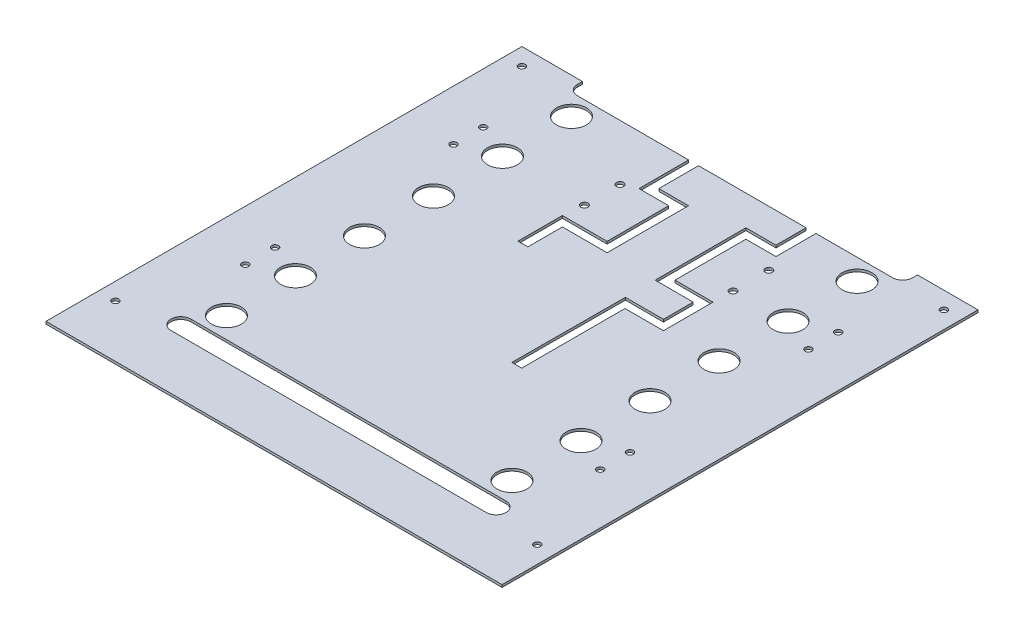
from build123d import *

# Parameters (mm, degrees)
SKETCH1_R                     = 2.15265
SKETCH1_R_2                   = 9.525
BOSS_EXTRUDE1_DEPTH           = 1.5875
CUT_EXTRUDE1_DEPTH            = 2.54
F_13_64_0_18_DIAMETER_HOLE1_D = 4.572


with BuildPart() as part:
    # Sketch1 → Boss-Extrude1 (new body)
    with BuildSketch(Plane(origin=(0, 0, 0), x_dir=(1, 0, 0), z_dir=(0, 1, 0))):
        with BuildLine():
            Line((-107.315, 152.4), (-146.05, 152.4))
            Line((-146.05, 152.4), (-146.05, -152.4))
            Line((-146.05, -152.4), (146.05, -152.4))
            Line((146.05, -152.4), (146.05, 152.4))
            Line((146.05, 152.4), (107.315, 152.4))
            Line((107.315, 152.4), (107.315, 149.225))
            ThreePointArc((107.315, 149.225), (105.455128061, 144.734871939), (100.965, 142.875))
            Line((100.965, 142.875), (-100.965, 142.875))
            ThreePointArc((-100.965, 142.875), (-105.455128061, 144.734871939), (-107.315, 149.225))
            Line((-107.315, 149.225), (-107.315, 152.4))
        make_face()
        with Locations(Location((-135.128, -118.872, 0), (0, 0, 270))):
            Circle(SKETCH1_R, mode=Mode.SUBTRACT)
        with Locations(Location((-91.44, -91.44, 0), (0, 0, 270))):
            Circle(SKETCH1_R_2, mode=Mode.SUBTRACT)
        with Locations(Location((-113.665, -57.15, 0), (0, 0, 270))):
            Circle(SKETCH1_R, mode=Mode.SUBTRACT)
        with Locations(Location((-113.665, -38.1, 0), (0, 0, 270))):
            Circle(SKETCH1_R, mode=Mode.SUBTRACT)
        with Locations(Location((-91.44, -47.244, 0), (0, 0, 270))):
            Circle(SKETCH1_R_2, mode=Mode.SUBTRACT)
        with Locations(Location((-91.44, -3.048, 0), (0, 0, 270))):
            Circle(SKETCH1_R_2, mode=Mode.SUBTRACT)
        with BuildLine():
            ThreePointArc((-100.965, -117.475), (-107.315, -111.125), (-100.965, -104.775))
            Line((-100.965, -104.775), (100.965, -104.775))
            ThreePointArc((100.965, -104.775), (107.315, -111.125), (100.965, -117.475))
            Line((100.965, -117.475), (-100.965, -117.475))
        make_face(mode=Mode.SUBTRACT)
        with Locations(Location((135.128, -118.872, 0), (0, 0, 270))):
            Circle(SKETCH1_R, mode=Mode.SUBTRACT)
        with Locations(Location((91.44, -91.44, 0), (0, 0, 270))):
            Circle(SKETCH1_R_2, mode=Mode.SUBTRACT)
        with Locations(Location((91.44, -47.244, 0), (0, 0, 270))):
            Circle(SKETCH1_R_2, mode=Mode.SUBTRACT)
        with Locations(Location((113.665, -57.15, 0), (0, 0, 270))):
            Circle(SKETCH1_R, mode=Mode.SUBTRACT)
        with Locations(Location((113.665, -38.1, 0), (0, 0, 270))):
            Circle(SKETCH1_R, mode=Mode.SUBTRACT)
        with Locations(Location((91.44, -3.048, 0), (0, 0, 270))):
            Circle(SKETCH1_R_2, mode=Mode.SUBTRACT)
        with Locations(Location((-113.665, 76.2, 0), (0, 0, 270))):
            Circle(SKETCH1_R, mode=Mode.SUBTRACT)
        with Locations(Location((-91.44, 41.148, 0), (0, 0, 270))):
            Circle(SKETCH1_R_2, mode=Mode.SUBTRACT)
        with Locations(Location((-113.665, 95.25, 0), (0, 0, 270))):
            Circle(SKETCH1_R, mode=Mode.SUBTRACT)
        with Locations(Location((-91.44, 85.344, 0), (0, 0, 270))):
            Circle(SKETCH1_R_2, mode=Mode.SUBTRACT)
        with Locations(Location((-135.128, 141.478, 0), (0, 0, 270))):
            Circle(SKETCH1_R, mode=Mode.SUBTRACT)
        with Locations(Location((-91.44, 129.54, 0), (0, 0, 270))):
            Circle(SKETCH1_R_2, mode=Mode.SUBTRACT)
        with Locations(Location((91.44, 41.148, 0), (0, 0, 270))):
            Circle(SKETCH1_R_2, mode=Mode.SUBTRACT)
        with Locations(Location((113.665, 76.2, 0), (0, 0, 270))):
            Circle(SKETCH1_R, mode=Mode.SUBTRACT)
        with Locations(Location((91.44, 85.344, 0), (0, 0, 270))):
            Circle(SKETCH1_R_2, mode=Mode.SUBTRACT)
        with Locations(Location((113.665, 95.25, 0), (0, 0, 270))):
            Circle(SKETCH1_R, mode=Mode.SUBTRACT)
        with Locations(Location((91.44, 129.54, 0), (0, 0, 270))):
            Circle(SKETCH1_R_2, mode=Mode.SUBTRACT)
        with Locations(Location((135.128, 141.478, 0), (0, 0, 270))):
            Circle(SKETCH1_R, mode=Mode.SUBTRACT)
    extrude(amount=BOSS_EXTRUDE1_DEPTH)

    # Sketch2 → Cut-Extrude1 (cut)
    with BuildSketch(Plane(origin=(0, 1.5875, 0), x_dir=(1, 0, 0), z_dir=(0, 1, 0))):
        Polygon((-23.413358533, 142.875), (-29.763358533, 142.875), (-29.763358533, 116.18638997), (-29.763358533, 111.10638997), (-23.413358533, 111.10638997), (-10.745128401, 111.10638997), (-10.745128401, 80.773994761), (-10.745128401, 71.647772826), (-39.37, 71.647772826), (-39.37, 54.61788987), (-39.37, 43.18), (-33.02, 43.18), (-33.02, 54.61788987), (-33.02, 65.297772826), (-4.395128401, 65.297772826), (-4.395128401, 74.423994761), (-4.395128401, 82.043994761), (-4.395128401, 111.10638997), (-4.395128401, 117.45638997), (-23.413358533, 117.45638997), align=None)
        Polygon((51.818643407, 142.875), (45.468643407, 142.875), (45.468643407, 123.598152459), (26.196923788, 123.598152459), (26.196923788, 117.248152459), (26.196923788, 65.497956958), (50.548643407, 65.497956958), (50.548643407, 46.447956958), (26.196923788, 46.447956958), (25.908, -26.035), (32.258, -26.035), (32.258, -6.148708856), (32.258, -3.919741149), (32.258, 40.097956958), (56.898643407, 40.097956958), (56.898643407, 71.847956958), (32.546923788, 71.847956958), (32.546923788, 117.248152459), (51.818643407, 117.248152459), align=None)
    extrude(amount=-CUT_EXTRUDE1_DEPTH, mode=Mode.SUBTRACT)

    # 13/64 (0.18) Diameter Hole1 (through all)
    with Locations(Plane(origin=(0, 0, 0), x_dir=(-1, 0, 0), z_dir=(0, -1, 0))):
        with Locations((-57.15, 107.315), (-57.15, 84.455), (38.1, 84.455), (38.1, 107.315)):
            Hole(F_13_64_0_18_DIAMETER_HOLE1_D / 2)


solid = part.part
